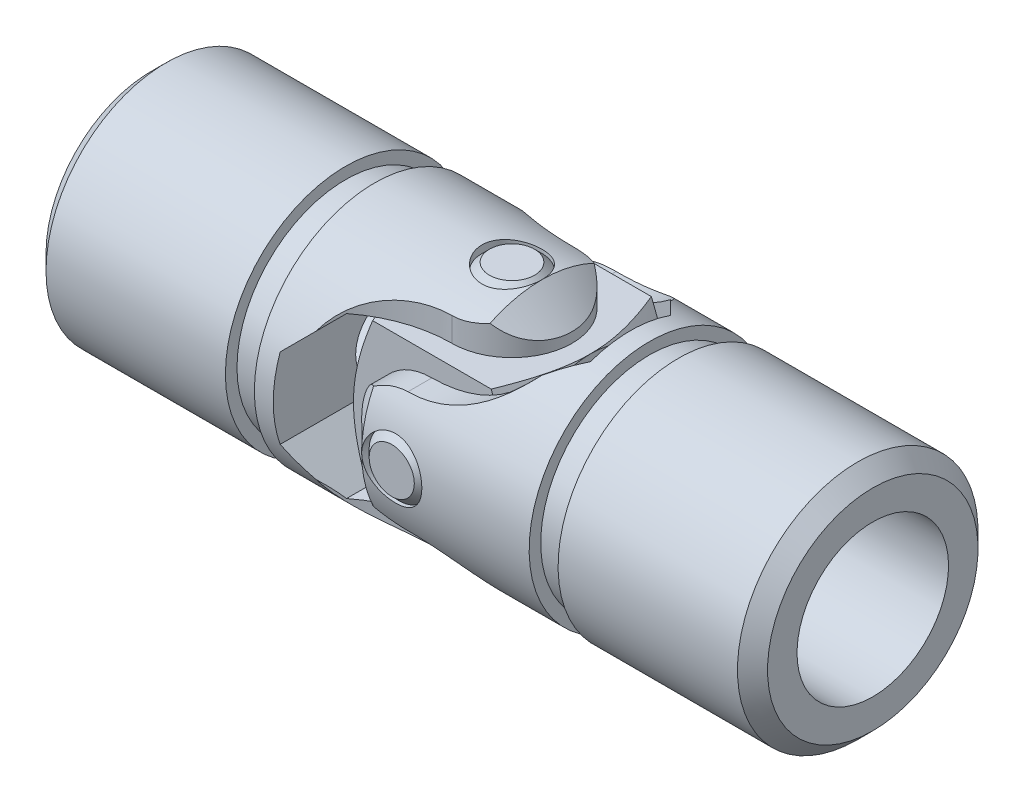
from build123d import *

# Parameters (mm, degrees)
CHAMFER1_SIZE               = 1.984375
CHAMFER2_SIZE               = 3.96875
EXTRUDE1_DEPTH              = 53.651418547
EXTRUDE1_DEPTH_BACK         = 53.651418547
EXTRUDE3_DEPTH              = 53.651418607
EXTRUDE3_DEPTH_BACK         = 53.651418607
SKETCH4_R                   = 10
EXTRUDE4_DEPTH              = 26.9875
EXTRUDE6_DEPTH              = 53.651418607
EXTRUDE6_DEPTH_BACK         = 53.651418607
SKETCH6_R                   = 3.96875
BODY_MOVE_COPY1_ANGLE       = 90
EXTRUDE10_REACH             = 54.651
SKETCH10_W                  = 20.70225
SKETCH10_H                  = 21.1455
EXTRUDE10_DIRECTION_2_REACH = 54.651
SKETCH11_OUTSIDE_W          = 273.642
SKETCH11_OUTSIDE_H          = 273.642
SKETCH11_OUTSIDE_R          = 10.57275
EXTRUDE11_DEPTH             = 63.171233914
EXTRUDE11_DRAFT             = -60
SKETCH12_OUTSIDE_W          = 302.597
SKETCH12_OUTSIDE_H          = 302.596
SKETCH12_OUTSIDE_R          = 10.57275
EXTRUDE12_DEPTH             = 71.529263769
EXTRUDE12_DRAFT             = 60
EXTRUDE13_DEPTH             = 53.651418607
EXTRUDE13_DEPTH_BACK        = 53.651418607
SKETCH13_R                  = 3.96875
SKETCH14_R                  = 3.96875
EXTRUDE14_DEPTH             = 15.875
EXTRUDE15_DEPTH             = 53.651418607
EXTRUDE15_DEPTH_BACK        = 53.651418607
SKETCH15_R                  = 3.96875
SKETCH16_R                  = 3.96875
EXTRUDE16_DEPTH             = 15.875
CHAMFER3_SIZE               = 0.9921875


with BuildPart() as part:
    # Sketch1 → Revolve1 (revolve)
    with BuildSketch(Plane(origin=(0, 0, 0), x_dir=(1, 0, 0), z_dir=(0, 1, 0)), mode=Mode.PRIVATE) as revolve1_sk:
        Polygon((-47.625, 15.875), (-21.957421875, 15.875), (-21.957421875, 14.34703125), (-18.1375, 14.34703125), (-18.1375, 15.875), (7.9375, 15.875), (7.9375, 0), (-47.625, 0), align=None)
    revolve(revolve1_sk.sketch.rotate(Axis((-47.625, 0, 0), (1, 0, 0)), 180), axis=Axis((-47.625, 0, 0), (1, 0, 0)))

    # Chamfer1
    chamfer1_edges = [part.edges().sort_by_distance(p)[0] for p in [
        (-47.625, 0, -15.875),
    ]]
    chamfer(chamfer1_edges, length=CHAMFER1_SIZE)

    # Chamfer2
    chamfer2_edges = [part.edges().sort_by_distance(p)[0] for p in [
        (7.9375, 0, -15.875),
    ]]
    chamfer(chamfer2_edges, length=CHAMFER2_SIZE)

    # Sketch2 → Extrude1 (cut, two sides: drawn at the far end of the back side and taken through both)
    with BuildSketch(Plane(origin=(0, 0, 0), x_dir=(1, 0, 0), z_dir=(0, 1, 0)).offset(-EXTRUDE1_DEPTH_BACK)):
        with BuildLine():
            Line((-14.317578125, 15.875), (15.875, 15.875))
            Line((15.875, 15.875), (15.875, -15.875))
            Line((15.875, -15.875), (-14.317578125, -15.875))
            ThreePointArc((-14.317578125, -15.875), (-8.185306189, -10.054629319), (0, -7.9375))
            ThreePointArc((0, -7.9375), (7.9375, 0), (0, 7.9375))
            ThreePointArc((0, 7.9375), (-8.185306189, 10.054629319), (-14.317578125, 15.875))
        make_face()
    extrude(amount=EXTRUDE1_DEPTH + EXTRUDE1_DEPTH_BACK, mode=Mode.SUBTRACT)

    # Sketch3 → Extrude3 (cut, two sides: drawn at the far end of the back side and taken through both)
    with BuildSketch(Plane.XY.offset(-EXTRUDE3_DEPTH_BACK)):
        Polygon((-10.351125, 10.57275), (-15.6375, 5.286375), (-15.6375, -5.286375), (-10.351125, -10.57275), (15.875, -10.57275), (15.875, 10.57275), align=None)
    extrude(amount=EXTRUDE3_DEPTH + EXTRUDE3_DEPTH_BACK, mode=Mode.SUBTRACT)

    # Sketch4 → Extrude4 (cut)
    with BuildSketch(Plane.ZY.offset(47.625)):
        Circle(SKETCH4_R)
    extrude(amount=-EXTRUDE4_DEPTH, mode=Mode.SUBTRACT)

    # Extrude5 cone 1 section (through the dimple's axis) → Extrude5 (revolve, cut)
    with BuildSketch(Plane(origin=(-20.6375, 0, 0), x_dir=(0, 0, 1), z_dir=(0, 1, 0))):
        Polygon((0, 0), (10, 0), (0, 10), align=None)
    revolve(axis=Axis((-20.6375, 0, 0), (1, 0, 0)), mode=Mode.SUBTRACT)

    # Sketch6 → Extrude6 (cut, two sides: drawn at the far end of the back side and taken through both)
    with BuildSketch(Plane(origin=(0, 0, 0), x_dir=(1, 0, 0), z_dir=(0, 1, 0)).offset(-EXTRUDE6_DEPTH_BACK)):
        with Locations(Location((0, 0, 0), (0, 0, 180))):
            Circle(SKETCH6_R)
    extrude(amount=EXTRUDE6_DEPTH + EXTRUDE6_DEPTH_BACK, mode=Mode.SUBTRACT)


with BuildPart() as body_2:
    # Mirror1: mirrored copy
    add(part.part.mirror(Plane(origin=(0, 0, 0), x_dir=(0, 0, 1), z_dir=(1, 0, 0))))


with BuildPart() as body_2_1:
    # Body-Move/Copy1: moved
    add(body_2.part.rotate(Axis((0, 0, 0), (1, 0, 0)), BODY_MOVE_COPY1_ANGLE))


with BuildPart() as body_3:

    # Extrude10: up to this face of the body (flat: up to its plane)
    extrude10_end = Plane(body_2_1.part.faces().sort_by_distance((10.057536965, 0, -10.57275))[0])
    # Sketch10 → Extrude10 (new, up to the picked face)
    with BuildSketch(Plane.XY, mode=Mode.PRIVATE) as extrude10_sk1:
        Rectangle(SKETCH10_W, SKETCH10_H)
    extrude10_tool1 = split(extrude(extrude10_sk1.sketch, amount=-EXTRUDE10_REACH, mode=Mode.PRIVATE), bisect_by=extrude10_end, keep=Keep.BOTH, mode=Mode.PRIVATE)
    add(extrude10_tool1.solids().sort_by(Axis((0, 0, 0), (0, 0, -1)))[0])


    # Extrude10 direction 2: up to this face of the body (flat: up to its plane)
    extrude10_direction_2_end = Plane(body_2_1.part.faces().sort_by_distance((5.56594077, -8.570790292, 10.57275))[0])
    # Sketch10 → Extrude10 direction 2 (add, up to the picked face)
    with BuildSketch(Plane.XY, mode=Mode.PRIVATE) as extrude10_direction_2_sk1:
        Rectangle(SKETCH10_W, SKETCH10_H)
    extrude10_direction_2_tool1 = split(extrude(extrude10_direction_2_sk1.sketch, amount=EXTRUDE10_DIRECTION_2_REACH, mode=Mode.PRIVATE), bisect_by=extrude10_direction_2_end, keep=Keep.BOTH, mode=Mode.PRIVATE)
    add(extrude10_direction_2_tool1.solids().sort_by(Axis((0, 0, 0), (0, 0, 1)))[0])


with BuildPart() as extrude11_tool:
    # Sketch11 outside → Extrude11 (with draft: the straight prism first)
    with BuildSketch(Plane(origin=(10.351125, 0, 0), x_dir=(0, 0, -1), z_dir=(1, 0, 0))):
        Rectangle(SKETCH11_OUTSIDE_W, SKETCH11_OUTSIDE_H)
        Circle(SKETCH11_OUTSIDE_R, mode=Mode.SUBTRACT)
    extrude(amount=-EXTRUDE11_DEPTH)
    # Extrude11: the draft: its side faces are tilted about the plane it starts from
    extrude11_sides = [extrude11_tool.faces().sort_by_distance(p)[0] for p in [
        (-21.234491957, -136.821, 0),
        (-21.234491957, 0, -136.821),
        (-21.234491957, 136.821, 0),
        (-21.234491957, 0, 136.821),
        (-21.234491957, 0, 10.57275),
    ]]
    draft(extrude11_sides, Plane(origin=(10.351125, 0, 0), x_dir=(0, 0, -1), z_dir=(1, 0, 0)), EXTRUDE11_DRAFT)


with BuildPart() as body_3_1:
    add(body_3.part)

    # Extrude11: cut by extrude11_tool
    add(extrude11_tool.part, mode=Mode.SUBTRACT)


with BuildPart() as extrude12_tool:
    # Sketch12 outside → Extrude12 (with draft: the straight prism first)
    with BuildSketch(Plane(origin=(-10.351125, -21.0185, 0), x_dir=(0, -1, 0), z_dir=(1, 0, 0))):
        with Locations((-21.0185, 0)):
            Rectangle(SKETCH12_OUTSIDE_W, SKETCH12_OUTSIDE_H)
        with Locations((-21.0185, 0)):
            Circle(SKETCH12_OUTSIDE_R, mode=Mode.SUBTRACT)
    extrude(amount=EXTRUDE12_DEPTH)
    # Extrude12: the draft: its side faces are tilted about the plane it starts from
    extrude12_sides = [extrude12_tool.faces().sort_by_distance(p)[0] for p in [
        (25.413506885, 0, 151.298),
        (25.413506885, -151.2985, 0),
        (25.413506885, 0, -151.298),
        (25.413506885, 151.2985, 0),
        (25.413506885, 10.57275, 0),
    ]]
    draft(extrude12_sides, Plane(origin=(-10.351125, -21.0185, 0), x_dir=(0, -1, 0), z_dir=(1, 0, 0)), EXTRUDE12_DRAFT)


with BuildPart() as body_3_2:
    add(body_3_1.part)

    # Extrude12: cut by extrude12_tool
    add(extrude12_tool.part, mode=Mode.SUBTRACT)

    # Sketch13 → Extrude13 (cut, two sides: drawn at the far end of the back side and taken through both)
    with BuildSketch(Plane(origin=(0, 0, 0), x_dir=(1, 0, 0), z_dir=(0, 1, 0)).offset(-EXTRUDE13_DEPTH_BACK)):
        with Locations(Location((0, 0, 0), (0, 0, 270))):
            Circle(SKETCH13_R)
    extrude(amount=EXTRUDE13_DEPTH + EXTRUDE13_DEPTH_BACK, mode=Mode.SUBTRACT)

    # Sketch15 → Extrude15 (cut, two sides: drawn at the far end of the back side and taken through both)
    with BuildSketch(Plane.XY.offset(-EXTRUDE15_DEPTH_BACK)):
        Circle(SKETCH15_R)
    extrude(amount=EXTRUDE15_DEPTH + EXTRUDE15_DEPTH_BACK, mode=Mode.SUBTRACT)


with BuildPart() as body_4:
    # Sketch14 → Extrude14 (new, symmetric)
    with BuildSketch(Plane(origin=(0, 0, 0), x_dir=(1, 0, 0), z_dir=(0, 1, 0))):
        with Locations(Location((0, 0, 0), (0, 0, 270))):
            Circle(SKETCH14_R)
    extrude(amount=EXTRUDE14_DEPTH, both=True)

    # Sketch16 → Extrude16 (add, symmetric)
    with BuildSketch(Plane.XY):
        Circle(SKETCH16_R)
    extrude(amount=EXTRUDE16_DEPTH, both=True)

    # Chamfer3
    chamfer3_edges = [body_4.edges().sort_by_distance(p)[0] for p in [
        (0, -15.875, -3.96875),
        (0, 15.875, -3.96875),
        (-3.96875, 0, -15.875),
        (-3.96875, 0, 15.875),
    ]]
    chamfer(chamfer3_edges, length=CHAMFER3_SIZE)


solid = Compound([part.part, body_2_1.part, body_3_2.part, body_4.part])
